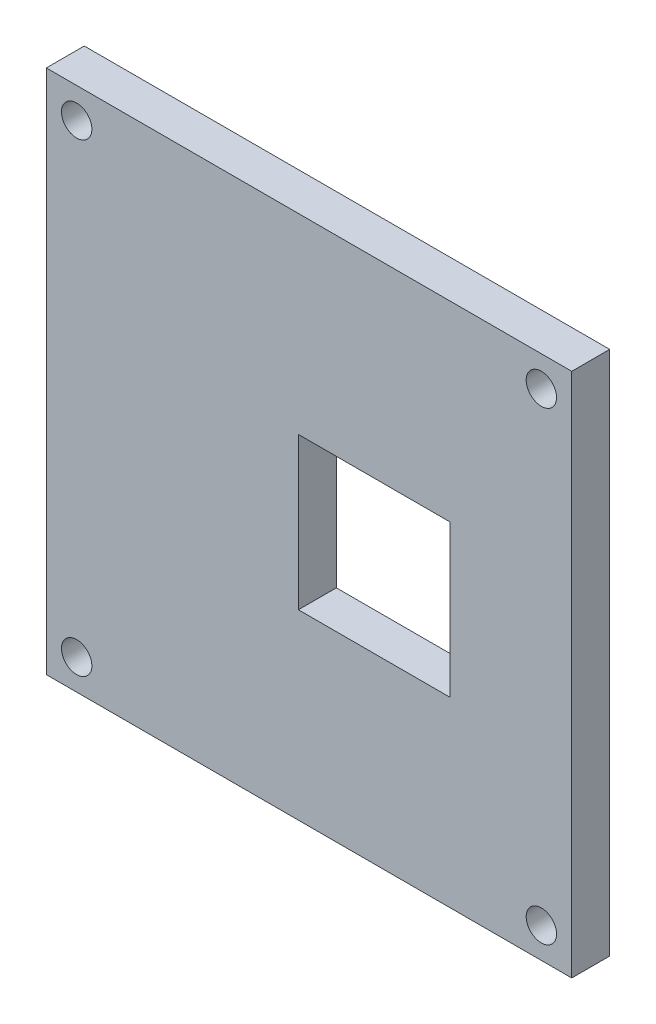
from build123d import *

# Parameters (mm, degrees)
SKETCH1_W           = 43.942
SKETCH1_H           = 43.942
SKETCH1_R           = 1.27
SKETCH1_W_2         = 12.7
SKETCH1_H_2         = 12.7
BOSS_EXTRUDE1_DEPTH = 3.175


with BuildPart() as part:
    # Sketch1 → Boss-Extrude1 (new body)
    with BuildSketch(Plane.XY):
        with Locations((21.971, 21.971)):
            Rectangle(SKETCH1_W, SKETCH1_H)
        with Locations((2.54, 41.402)):
            Circle(SKETCH1_R, mode=Mode.SUBTRACT)
        with Locations((41.402, 41.402)):
            Circle(SKETCH1_R, mode=Mode.SUBTRACT)
        with Locations((41.402, 2.54)):
            Circle(SKETCH1_R, mode=Mode.SUBTRACT)
        with Locations((2.54, 2.54)):
            Circle(SKETCH1_R, mode=Mode.SUBTRACT)
        with Locations((27.432, 21.59)):
            Rectangle(SKETCH1_W_2, SKETCH1_H_2, mode=Mode.SUBTRACT)
    extrude(amount=BOSS_EXTRUDE1_DEPTH)


solid = part.part
